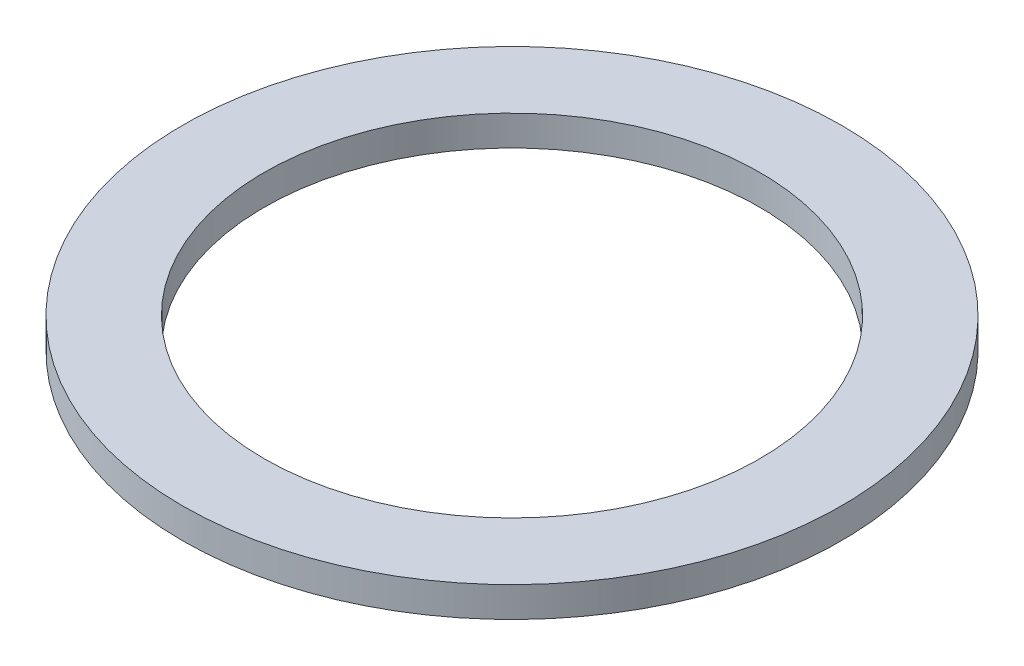
from build123d import *

# Parameters (mm, degrees)
SKETCH1_R           = 5.45
SKETCH1_R_2         = 4.1
BOSS_EXTRUDE1_DEPTH = 0.5


with BuildPart() as part:
    # Sketch1 → Boss-Extrude1 (new body)
    with BuildSketch(Plane(origin=(0, 0, 0), x_dir=(1, 0, 0), z_dir=(0, 1, 0))):
        with Locations(Location((0, 0, 0), (0, 0, 270))):
            Circle(SKETCH1_R)
        with Locations(Location((0, 0, 0), (0, 0, 270))):
            Circle(SKETCH1_R_2, mode=Mode.SUBTRACT)
    extrude(amount=BOSS_EXTRUDE1_DEPTH)


solid = part.part
